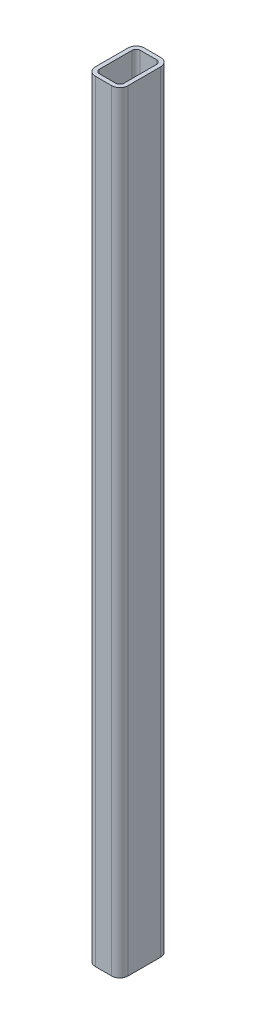
from build123d import *

# Parameters (mm, degrees)
TUBO_RECTANGULAR_3_X_2_X_0_25_1_DEPTH = 1200


with BuildPart() as part:
    # Sketch1 → Tubo rectangular 3 X 2 X 0.25(1) (new body)
    with BuildSketch(Plane(origin=(0, 0, 0), x_dir=(-1, 0, 0), z_dir=(0, 1, 0))):
        with BuildLine():
            Line((-12.699978, -38.1), (12.699978, -38.1))
            ThreePointArc((12.699978, -38.1), (21.680234121, -34.380256121), (25.399978, -25.4))
            Line((25.399978, -25.4), (25.399978, 25.4))
            ThreePointArc((25.399978, 25.4), (21.680234121, 34.380256121), (12.699978, 38.1))
            Line((12.699978, 38.1), (-12.699978, 38.1))
            ThreePointArc((-12.699978, 38.1), (-21.680234121, 34.380256121), (-25.399978, 25.4))
            Line((-25.399978, 25.4), (-25.399978, -25.4))
            ThreePointArc((-25.399978, -25.4), (-21.680234121, -34.380256121), (-12.699978, -38.1))
        make_face()
        with BuildLine():
            Line((-12.699978, -31.75), (12.699978, -31.75))
            ThreePointArc((12.699978, -31.75), (17.190106061, -29.890128061), (19.049978, -25.4))
            Line((19.049978, -25.4), (19.049978, 25.4))
            ThreePointArc((19.049978, 25.4), (17.190106061, 29.890128061), (12.699978, 31.75))
            Line((12.699978, 31.75), (-12.699978, 31.75))
            ThreePointArc((-12.699978, 31.75), (-17.190106061, 29.890128061), (-19.049978, 25.4))
            Line((-19.049978, 25.4), (-19.049978, -25.4))
            ThreePointArc((-19.049978, -25.4), (-17.190106061, -29.890128061), (-12.699978, -31.75))
        make_face(mode=Mode.SUBTRACT)
    extrude(amount=TUBO_RECTANGULAR_3_X_2_X_0_25_1_DEPTH)


solid = part.part
